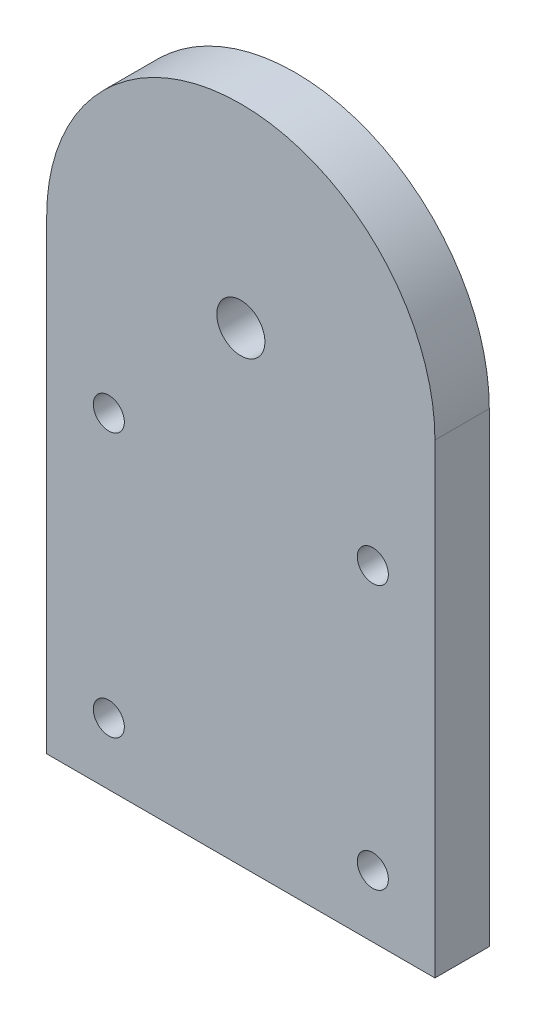
from build123d import *
from build123d.topology import SkipClean

# Parameters (mm, degrees)
SKIZZE1_R                       = 3.1
SKIZZE1_R_2                     = 2
AUFSATZ_LINEAR_AUSTRAGEN1_DEPTH = 7
AUFSATZ_LINEAR_START            = 7
SKIZZE2_R                       = 5.95
SKIZZE2_R_2                     = 3.1
AUFSATZ_LINEAR_AUSTRAGEN2_DEPTH = 7
AUFSATZ_LINEAR_START_2          = 5
SKIZZE3_R                       = 11
SKIZZE3_R_2                     = 5.95
AUFSATZ_LINEAR_AUSTRAGEN3_DEPTH = 5


with BuildPart() as part:
    # Skizze1 → Aufsatz-Linear austragen1 (new body)
    with BuildSketch(Plane.XY):
        with BuildLine():
            Line((-25, 0), (-25, -60))
            Line((-25, -60), (25, -60))
            Line((25, -60), (25, 0))
            ThreePointArc((25, 0), (0, 25), (-25, 0))
        make_face()
        Circle(SKIZZE1_R, mode=Mode.SUBTRACT)
        with Locations((-17, -18)):
            Circle(SKIZZE1_R_2, mode=Mode.SUBTRACT)
        with Locations(Location((-17, -52, 0), (0, 0, 180))):
            Circle(SKIZZE1_R_2, mode=Mode.SUBTRACT)
        with Locations(Location((17, -18, 0), (0, 0, 180))):
            Circle(SKIZZE1_R_2, mode=Mode.SUBTRACT)
        with Locations((17, -52)):
            Circle(SKIZZE1_R_2, mode=Mode.SUBTRACT)
    extrude(amount=AUFSATZ_LINEAR_AUSTRAGEN1_DEPTH)

    # Skizze2 → Aufsatz-Linear austragen2 (add)
    with SkipClean():  # the faces are left unmerged after this step: merging them gives an invalid solid
        with BuildSketch(Plane(origin=(0, 0, 0), x_dir=(-1, 0, 0), z_dir=(0, 0, -1)).offset(AUFSATZ_LINEAR_START)):
            with Locations(Location((0, 0, 0), (0, 0, 180))):
                Circle(SKIZZE2_R)
            Circle(SKIZZE2_R_2, mode=Mode.SUBTRACT)
        extrude(amount=-AUFSATZ_LINEAR_AUSTRAGEN2_DEPTH)

    # Skizze3 → Aufsatz-Linear austragen3 (add)
    with SkipClean():  # the faces are left unmerged after this step: merging them gives an invalid solid
        with BuildSketch(Plane(origin=(0, 0, 0), x_dir=(-1, 0, 0), z_dir=(0, 0, -1)).offset(AUFSATZ_LINEAR_START_2)):
            with Locations(Location((0, 0, 0), (0, 0, 180))):
                Circle(SKIZZE3_R)
            Circle(SKIZZE3_R_2, mode=Mode.SUBTRACT)
        extrude(amount=-AUFSATZ_LINEAR_AUSTRAGEN3_DEPTH)


solid = part.part
